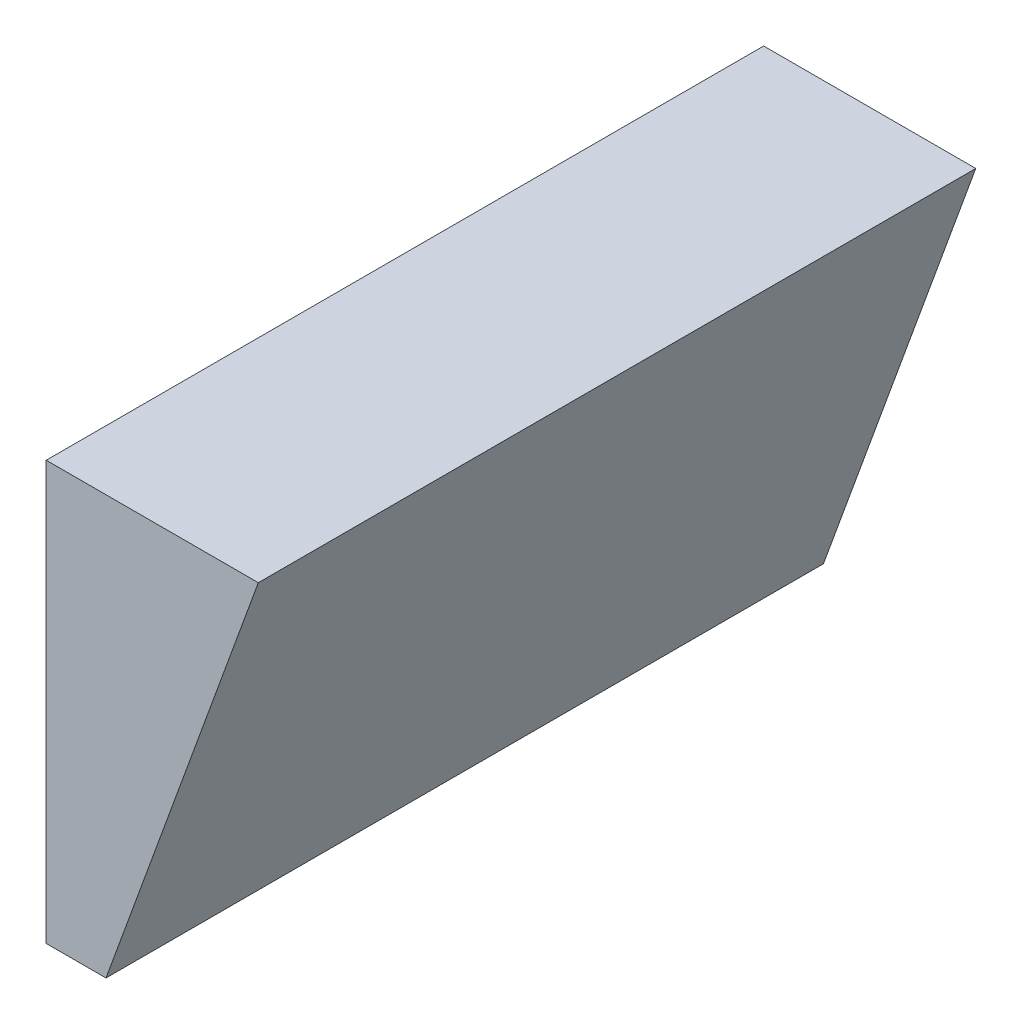
from build123d import *

# Parameters (mm, degrees)
BOSS_EXTRUDE1_DEPTH = 60


with BuildPart() as part:
    # Sketch1 → Boss-Extrude1 (new body)
    with BuildSketch(Plane.XY):
        Polygon((0, 0), (0, 35), (17.738958199, 35), (5, 0), align=None)
    extrude(amount=BOSS_EXTRUDE1_DEPTH)


solid = part.part
